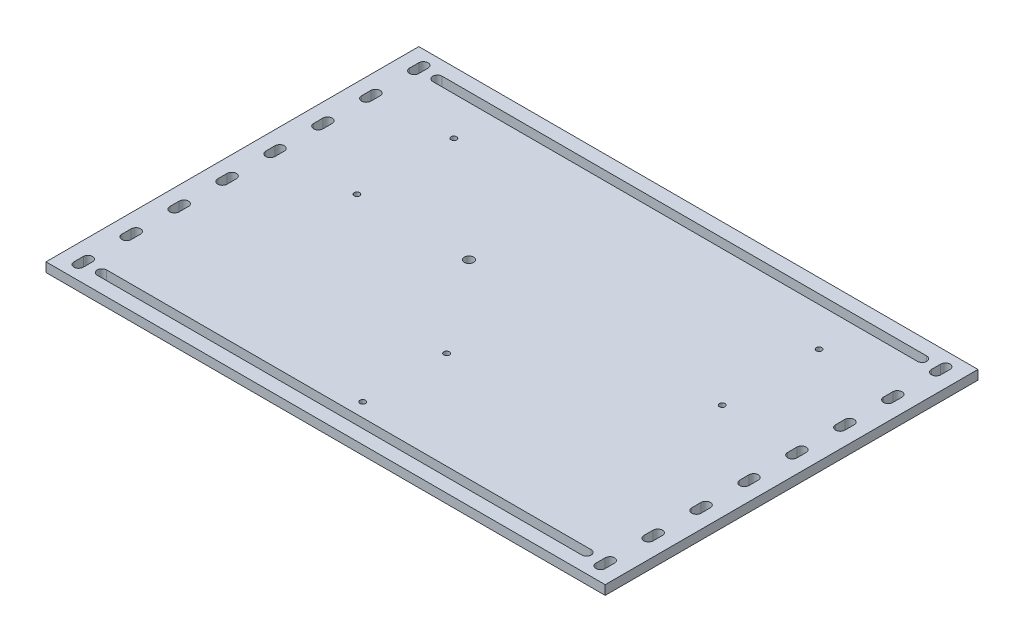
from build123d import *

# Parameters (mm, degrees)
SKETCH_1_W          = 300
SKETCH_1_H          = 200
EXTRUDE_1_DEPTH     = 5
SKETCH_3_R          = 1.5
SKETCH_3_R_2        = 2.5
CUT_EXTRUDE_1_DEPTH = 181.346887969


with BuildPart() as part:
    # 草圖1 → 填料-伸長1 (new body)
    with BuildSketch(Plane(origin=(0, 0, 0), x_dir=(1, 0, 0), z_dir=(0, 1, 0))):
        Rectangle(SKETCH_1_W, SKETCH_1_H)
        with BuildLine():
            Line((-137.5, 92.5), (-137.5, 87.5))
            ThreePointArc((-137.5, 87.5), (-140, 85), (-142.5, 87.5))
            Line((-142.5, 87.5), (-142.5, 92.5))
            ThreePointArc((-142.5, 92.5), (-140, 95), (-137.5, 92.5))
        make_face(mode=Mode.SUBTRACT)
        with BuildLine():
            Line((-137.5, 66.785714286), (-137.5, 61.785714286))
            ThreePointArc((-137.5, 61.785714286), (-140, 59.285714286), (-142.5, 61.785714286))
            Line((-142.5, 61.785714286), (-142.5, 66.785714286))
            ThreePointArc((-142.5, 66.785714286), (-140, 69.285714286), (-137.5, 66.785714286))
        make_face(mode=Mode.SUBTRACT)
        with BuildLine():
            Line((-137.5, 41.071428571), (-137.5, 36.071428571))
            ThreePointArc((-137.5, 36.071428571), (-140, 33.571428571), (-142.5, 36.071428571))
            Line((-142.5, 36.071428571), (-142.5, 41.071428571))
            ThreePointArc((-142.5, 41.071428571), (-140, 43.571428571), (-137.5, 41.071428571))
        make_face(mode=Mode.SUBTRACT)
        with BuildLine():
            Line((-137.5, 15.357142857), (-137.5, 10.357142857))
            ThreePointArc((-137.5, 10.357142857), (-140, 7.857142857), (-142.5, 10.357142857))
            Line((-142.5, 10.357142857), (-142.5, 15.357142857))
            ThreePointArc((-142.5, 15.357142857), (-140, 17.857142857), (-137.5, 15.357142857))
        make_face(mode=Mode.SUBTRACT)
        with BuildLine():
            Line((-137.5, -10.357142857), (-137.5, -15.357142857))
            ThreePointArc((-137.5, -15.357142857), (-140, -17.857142857), (-142.5, -15.357142857))
            Line((-142.5, -15.357142857), (-142.5, -10.357142857))
            ThreePointArc((-142.5, -10.357142857), (-140, -7.857142857), (-137.5, -10.357142857))
        make_face(mode=Mode.SUBTRACT)
        with BuildLine():
            Line((-137.5, -36.071428571), (-137.5, -41.071428571))
            ThreePointArc((-137.5, -41.071428571), (-140, -43.571428571), (-142.5, -41.071428571))
            Line((-142.5, -41.071428571), (-142.5, -36.071428571))
            ThreePointArc((-142.5, -36.071428571), (-140, -33.571428571), (-137.5, -36.071428571))
        make_face(mode=Mode.SUBTRACT)
        with BuildLine():
            Line((-137.5, -61.785714286), (-137.5, -66.785714286))
            ThreePointArc((-137.5, -66.785714286), (-140, -69.285714286), (-142.5, -66.785714286))
            Line((-142.5, -66.785714286), (-142.5, -61.785714286))
            ThreePointArc((-142.5, -61.785714286), (-140, -59.285714286), (-137.5, -61.785714286))
        make_face(mode=Mode.SUBTRACT)
        with BuildLine():
            Line((-137.5, -87.5), (-137.5, -92.5))
            ThreePointArc((-137.5, -92.5), (-140, -95), (-142.5, -92.5))
            Line((-142.5, -92.5), (-142.5, -87.5))
            ThreePointArc((-142.5, -87.5), (-140, -85), (-137.5, -87.5))
        make_face(mode=Mode.SUBTRACT)
        with BuildLine():
            Line((137.5, 92.5), (137.5, 87.5))
            ThreePointArc((137.5, 87.5), (140, 85), (142.5, 87.5))
            Line((142.5, 87.5), (142.5, 92.5))
            ThreePointArc((142.5, 92.5), (140, 95), (137.5, 92.5))
        make_face(mode=Mode.SUBTRACT)
        with BuildLine():
            Line((137.5, 66.785714286), (137.5, 61.785714286))
            ThreePointArc((137.5, 61.785714286), (140, 59.285714286), (142.5, 61.785714286))
            Line((142.5, 61.785714286), (142.5, 66.785714286))
            ThreePointArc((142.5, 66.785714286), (140, 69.285714286), (137.5, 66.785714286))
        make_face(mode=Mode.SUBTRACT)
        with BuildLine():
            Line((137.5, 41.071428571), (137.5, 36.071428571))
            ThreePointArc((137.5, 36.071428571), (140, 33.571428571), (142.5, 36.071428571))
            Line((142.5, 36.071428571), (142.5, 41.071428571))
            ThreePointArc((142.5, 41.071428571), (140, 43.571428571), (137.5, 41.071428571))
        make_face(mode=Mode.SUBTRACT)
        with BuildLine():
            Line((-130, -87.5), (130, -87.5))
            ThreePointArc((130, -87.5), (132.5, -90), (130, -92.5))
            Line((130, -92.5), (-130, -92.5))
            ThreePointArc((-130, -92.5), (-132.5, -90), (-130, -87.5))
        make_face(mode=Mode.SUBTRACT)
        with BuildLine():
            Line((-130, 92.5), (130, 92.5))
            ThreePointArc((130, 92.5), (132.5, 90), (130, 87.5))
            Line((130, 87.5), (-130, 87.5))
            ThreePointArc((-130, 87.5), (-132.5, 90), (-130, 92.5))
        make_face(mode=Mode.SUBTRACT)
        with BuildLine():
            Line((137.5, 15.357142857), (137.5, 10.357142857))
            ThreePointArc((137.5, 10.357142857), (140, 7.857142857), (142.5, 10.357142857))
            Line((142.5, 10.357142857), (142.5, 15.357142857))
            ThreePointArc((142.5, 15.357142857), (140, 17.857142857), (137.5, 15.357142857))
        make_face(mode=Mode.SUBTRACT)
        with BuildLine():
            Line((137.5, -10.357142857), (137.5, -15.357142857))
            ThreePointArc((137.5, -15.357142857), (140, -17.857142857), (142.5, -15.357142857))
            Line((142.5, -15.357142857), (142.5, -10.357142857))
            ThreePointArc((142.5, -10.357142857), (140, -7.857142857), (137.5, -10.357142857))
        make_face(mode=Mode.SUBTRACT)
        with BuildLine():
            Line((137.5, -36.071428571), (137.5, -41.071428571))
            ThreePointArc((137.5, -41.071428571), (140, -43.571428571), (142.5, -41.071428571))
            Line((142.5, -41.071428571), (142.5, -36.071428571))
            ThreePointArc((142.5, -36.071428571), (140, -33.571428571), (137.5, -36.071428571))
        make_face(mode=Mode.SUBTRACT)
        with BuildLine():
            Line((137.5, -61.785714286), (137.5, -66.785714286))
            ThreePointArc((137.5, -66.785714286), (140, -69.285714286), (142.5, -66.785714286))
            Line((142.5, -66.785714286), (142.5, -61.785714286))
            ThreePointArc((142.5, -61.785714286), (140, -59.285714286), (137.5, -61.785714286))
        make_face(mode=Mode.SUBTRACT)
        with BuildLine():
            Line((137.5, -87.5), (137.5, -92.5))
            ThreePointArc((137.5, -92.5), (140, -95), (142.5, -92.5))
            Line((142.5, -92.5), (142.5, -87.5))
            ThreePointArc((142.5, -87.5), (140, -85), (137.5, -87.5))
        make_face(mode=Mode.SUBTRACT)
    extrude(amount=EXTRUDE_1_DEPTH)

    # 草圖3 → 除料-伸長1 (cut, through all)
    with BuildSketch(Plane(origin=(0, 5, 0), x_dir=(1, 0, 0), z_dir=(0, 1, 0))):
        with Locations(Location((0, -80.078865529, 0), (0, 0, 270))):
            Circle(SKETCH_3_R)
        with Locations(Location((0, -35.078865529, 0), (0, 0, 270))):
            Circle(SKETCH_3_R)
        with Locations(Location((-98, 14.785714286, 0), (0, 0, 270))):
            Circle(SKETCH_3_R)
        with Locations(Location((-98, 66.785714286, 0), (0, 0, 270))):
            Circle(SKETCH_3_R)
        with Locations(Location((98, 14.785714286, 0), (0, 0, 90))):
            Circle(SKETCH_3_R)
        with Locations(Location((98, 66.785714286, 0), (0, 0, 90))):
            Circle(SKETCH_3_R)
        with Locations(Location((-37.5, 14.421134471, 0), (0, 0, 270))):
            Circle(SKETCH_3_R_2)
    extrude(amount=-CUT_EXTRUDE_1_DEPTH, mode=Mode.SUBTRACT)


solid = part.part
